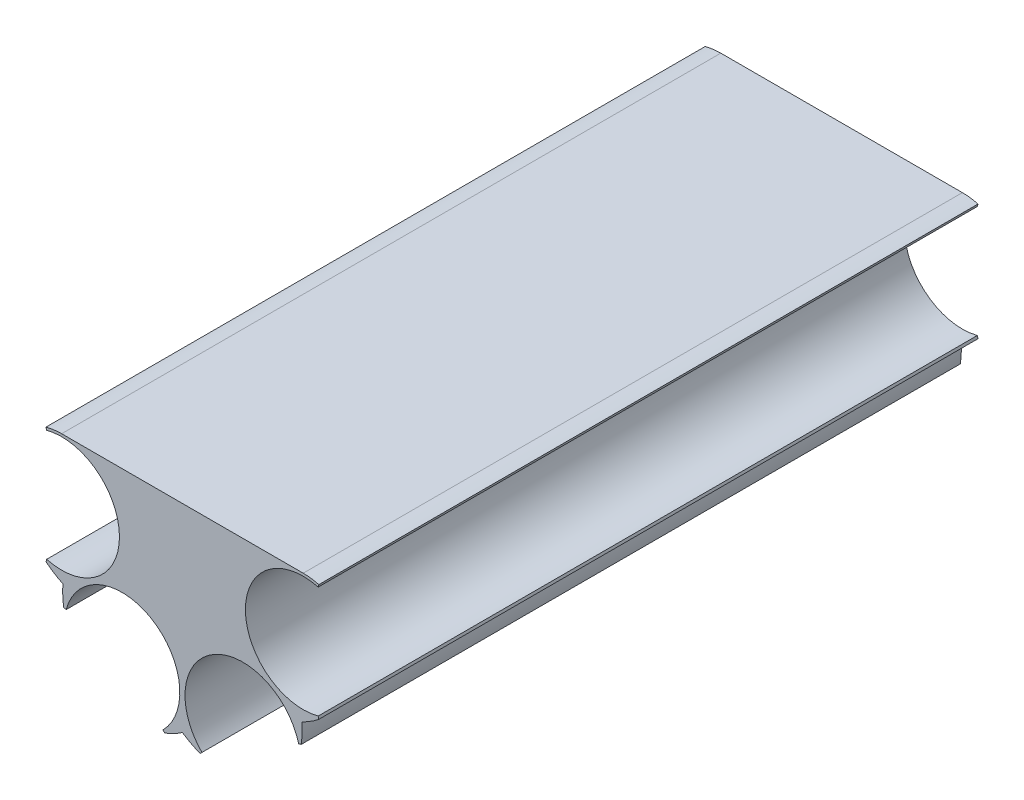
from build123d import *

# Parameters (mm, degrees)
BOSS_EXTRU_1_DEPTH = 191


with BuildPart() as part:
    # Esquisse1 → Boss.-Extru.1 (new body)
    with BuildSketch(Plane.XY):
        with BuildLine():
            Line((-39.529333289, 16.90370196), (-39.335219005, 16.17925759))
            ThreePointArc((-39.335219005, 16.17925759), (-18.25, 0), (-39.335219005, -16.17925759))
            Line((-39.335219005, -16.17925759), (-39.529333289, -16.90370196))
            ThreePointArc((-39.529333289, -16.90370196), (-37.17213026, -18.592337614), (-34.635254916, -19.996673749))
            ThreePointArc((-34.635254916, -19.996673749), (-34.68750182, -22.895840311), (-34.40370196, -25.781555843))
            Line((-34.40370196, -25.781555843), (-33.67925759, -25.975670127))
            ThreePointArc((-33.67925759, -25.975670127), (-9.125, -15.804963619), (-5.655961415, -42.154927717))
            Line((-5.655961415, -42.154927717), (-5.125631329, -42.685257803))
            ThreePointArc((-5.125631329, -42.685257803), (-2.48462844, -41.488177925), (0, -39.993347498))
            ThreePointArc((0, -39.993347498), (2.48462844, -41.488177925), (5.125631329, -42.685257803))
            Line((5.125631329, -42.685257803), (5.655961415, -42.154927717))
            ThreePointArc((5.655961415, -42.154927717), (9.125, -15.804963619), (33.67925759, -25.975670127))
            Line((33.67925759, -25.975670127), (34.40370196, -25.781555843))
            ThreePointArc((34.40370196, -25.781555843), (34.68750182, -22.895840311), (34.635254916, -19.996673749))
            ThreePointArc((34.635254916, -19.996673749), (37.17213026, -18.592337614), (39.529333289, -16.90370196))
            Line((39.529333289, -16.90370196), (39.335219005, -16.17925759))
            ThreePointArc((39.335219005, -16.17925759), (18.25, 0), (39.335219005, 16.17925759))
            Line((39.335219005, 16.17925759), (39.529333289, 16.90370196))
            ThreePointArc((39.529333289, 16.90370196), (37.284208364, 17.350285074), (35, 17.5))
            Line((35, 17.5), (-35, 17.5))
            ThreePointArc((-35, 17.5), (-37.284208364, 17.350285074), (-39.529333289, 16.90370196))
        make_face()
    extrude(amount=BOSS_EXTRU_1_DEPTH)


solid = part.part
